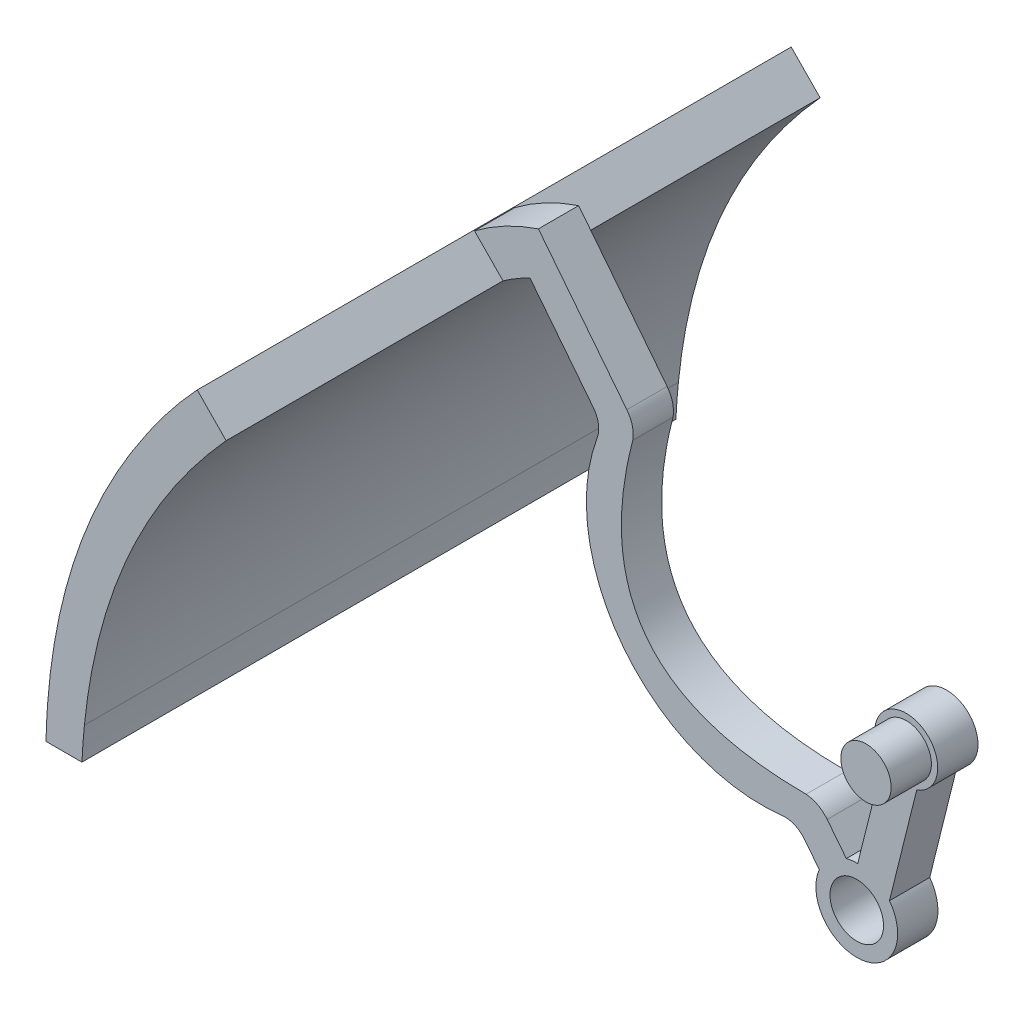
from build123d import *

# Parameters (mm, degrees)
BOSS_EXTRUDE1_DEPTH      = 74.93
BOSS_EXTRUDE4_DEPTH      = 2.54
BOSS_EXTRUDE4_DEPTH_BACK = 2.54
BOSS_EXTRUDE6_DEPTH      = 74.93
BOSS_EXTRUDE7_DEPTH      = 74.93
SKETCH11_R               = 3.3782
BOSS_EXTRUDE8_DEPTH      = 2.54
SKETCH13_R               = 3.971263101
BOSS_EXTRUDE10_DEPTH     = 5.08
SKETCH12_R               = 3.175
BOSS_EXTRUDE9_DEPTH      = 5.08


with BuildPart() as part:
    # Sketch1 → Boss-Extrude1 (new body)
    with BuildSketch(Plane.XY):
        with BuildLine():
            Line((-16.295773791, 0.624640473), (-12.907508233, 0.624640473))
            Line((-12.907508233, 0.624640473), (-12.443267089, 3.164640473))
            add(Edge.make_bspline(
                [(-12.443267089, 3.164640473), (-12.30668745, 3.911907895), (-11.89696139, 6.153716378), (-11.35075536, 9.142778811), (-10.941162808, 11.384616955), (-10.804635025, 12.131895145)],
                knots=[0.002076118, 0.002076118, 0.002076118, 0.002076118, 0.004355051, 0.008912916, 0.011191849, 0.011191849, 0.011191849, 0.011191849], degree=3))
            add(Edge.make_bspline(
                [(-10.804635025, 12.131895145), (-10.131787944, 14.813925559), (-8.428636773, 20.08894476), (-4.769918918, 27.602373316), (-0.882056925, 33.370017928), (2.696640916, 37.629074894), (4.663596703, 39.6688962), (5.677623009, 40.647244333)],
                knots=[-0.595137067, -0.595137067, -0.595137067, -0.595137067, -0.254899084, 0.0853389, 0.425576884, 0.595695875, 0.765814867, 0.765814867, 0.765814867, 0.765814867], degree=3))
            Line((5.677623009, 40.647244333), (2.03170084, 44.371046934))
            add(Edge.make_bspline(
                [(2.03170084, 44.371046934), (1.545061943, 43.849333503), (0.584048879, 42.784657511), (-1.227882281, 40.634272171), (-4.205920413, 36.737641226), (-7.868630072, 30.842728735), (-11.285075765, 23.259160615), (-12.891126954, 17.928422411), (-13.516382283, 15.22778531)],
                knots=[0.192222826, 0.192222826, 0.192222826, 0.192222826, 0.287167093, 0.38211136, 0.571999893, 0.951776961, 1.331554028, 1.711331096, 1.711331096, 1.711331096, 1.711331096], degree=3))
            add(Edge.make_bspline(
                [(-13.516382283, 15.22778531), (-13.707651088, 14.222513225), (-14.09021448, 12.211975656), (-14.664139503, 9.196174334), (-15.238140346, 6.180406911), (-15.620861993, 4.169893716), (-15.812232602, 3.164640473)],
                knots=[-0.00268258, -0.00268258, -0.00268258, -0.00268258, 0.000387339, 0.003457258, 0.006527177, 0.009597097, 0.009597097, 0.009597097, 0.009597097], degree=3))
            Line((-15.812232602, 3.164640473), (-16.295773791, 0.624640473))
        make_face()
    extrude(amount=BOSS_EXTRUDE1_DEPTH)

    # Sketch4 → Boss-Extrude4 (add, two sides: drawn at the far end of the back side and taken through both)
    with BuildSketch(Plane(origin=(0, 0, 37.465), x_dir=(-1, 0, 0), z_dir=(0, 0, -1)).offset(-BOSS_EXTRUDE4_DEPTH_BACK)):
        with BuildLine():
            Line((-5.677623009, 40.647244333), (-2.087143894, 44.314419562))
            ThreePointArc((-2.087143894, 44.314419562), (-5.945357936, 46.761917563), (-10.144870483, 48.561961011))
            Line((-10.144870483, 48.561961011), (-12.342217859, 43.933321468))
            ThreePointArc((-12.342217859, 43.933321468), (-8.878894593, 42.556020468), (-5.677623009, 40.647244333))
        make_face()
    extrude(amount=BOSS_EXTRUDE4_DEPTH + BOSS_EXTRUDE4_DEPTH_BACK)

    # Sketch8 → Boss-Extrude6 (add)
    with BuildSketch(Plane(origin=(0, 0, 0), x_dir=(-1, 0, 0), z_dir=(0, 0, -1))):
        with BuildLine():
            Line((12.199993526, 0.628671187), (16.843743367, 0.628671187))
            add(Edge.make_bspline(
                [(-2.03170084, 44.371046934), (15.008940659, 25.494574417), (16.843743367, 0.628671187)],
                knots=[0, 0, 0, 1, 1, 1], degree=2))
            Line((-2.03170084, 44.371046934), (-5.677623009, 40.647244333))
            add(Edge.make_bspline(
                [(-5.677623009, 40.647244333), (9.879032096, 23.52153238), (12.199993526, 0.628671187)],
                knots=[0, 0, 0, 1, 1, 1], degree=2))
        make_face()
    extrude(amount=-BOSS_EXTRUDE6_DEPTH)

    # Sketch10 → Boss-Extrude7 (add)
    with BuildSketch(Plane.XY.offset(74.93)):
        with BuildLine():
            add(Edge.make_bspline(
                [(-17.044210577, -3.569022053), (-16.99706974, -1.449262713), (-16.843743367, 0.628671187)],
                knots=[0, 0, 0, 1, 1, 1], degree=2))
            Line((-16.843743367, 0.628671187), (-16.295006462, 0.628671187))
            Line((-16.295006462, 0.628671187), (-16.295773791, 0.624640473))
            Line((-16.295773791, 0.624640473), (-12.907508233, 0.624640473))
            Line((-12.907508233, 0.624640473), (-12.906771531, 0.628671187))
            Line((-12.906771531, 0.628671187), (-12.199993526, 0.628671187))
            add(Edge.make_bspline(
                [(-12.199993526, 0.628671187), (-12.410380076, -1.44648182), (-12.512012235, -3.569022053)],
                knots=[0, 0, 0, 1, 1, 1], degree=2))
            Line((-12.512012235, -3.569022053), (-17.044210577, -3.569022053))
        make_face()
    extrude(amount=-BOSS_EXTRUDE7_DEPTH)

    # Sketch11 → Boss-Extrude8 (add, symmetric)
    with BuildSketch(Plane(origin=(0, 0, 37.465), x_dir=(-1, 0, 0), z_dir=(0, 0, -1))):
        with BuildLine():
            Line((-6.661684739, 45.739942581), (-10.144870483, 48.561961011))
            Line((-10.144870483, 48.561961011), (-21.30072948, 34.383167777))
            ThreePointArc((-21.30072948, 34.383167777), (-21.992768178, 32.976186787), (-22.052439991, 31.409358033))
            add(Edge.make_bspline(
                [(-43.921175132, 3.682891736), (-14.804010115, 3.685410597), (-22.052439991, 31.409358033)],
                knots=[0, 0, 0, 1, 1, 1], degree=2))
            ThreePointArc((-43.921175132, 3.682891736), (-45.398270297, 3.247037241), (-46.577742371, 2.256772178))
            Line((-46.577742371, 2.256772178), (-48.989981542, -0.809118172))
            ThreePointArc((-48.989981542, -0.809118172), (-49.700911454, -0.673916534), (-50.423765203, -0.639517698))
            Line((-50.423765203, -0.639517698), (-54.431438085, 15.399576445))
            ThreePointArc((-54.431438085, 15.399576445), (-57.076455171, 16.988173168), (-58.666731899, 14.344165819))
            Line((-58.666731899, 14.344165819), (-54.431438085, -2.697927839))
            ThreePointArc((-54.431438085, -2.697927839), (-50.902490469, -10.922372789), (-45.581657306, -3.726283541))
            Line((-45.581657306, -3.726283541), (-43.706337234, -1.342802757))
            ThreePointArc((-43.706337234, -1.342802757), (-42.430425985, -0.374532318), (-40.844196848, -0.152329073))
            ThreePointArc((-40.844196848, -0.152329073), (-20.926969962, 8.132007566), (-17.561546975, 29.439285396))
            ThreePointArc((-17.561546975, 29.439285396), (-17.718806517, 31.033263625), (-17.077929798, 32.501178536))
            Line((-17.077929798, 32.501178536), (-11.948808892, 39.020151644))
            Line((-11.948808892, 39.020151644), (-6.661684739, 45.739942581))
        make_face()
        with Locations((-50.306976812, -5.797526095)):
            Circle(SKETCH11_R, mode=Mode.SUBTRACT)
    extrude(amount=BOSS_EXTRUDE8_DEPTH, both=True)

    # Sketch13 → Boss-Extrude10 (add)
    with BuildSketch(Plane.XY.offset(40.005)):
        with Locations((56.548749752, 14.870525834)):
            Circle(SKETCH13_R)
    extrude(amount=-BOSS_EXTRUDE10_DEPTH)

    # Sketch12 → Boss-Extrude9 (add)
    with BuildSketch(Plane.XY.offset(40.005)):
        with Locations(Location((56.548749752, 14.870525834, 0), (0, 0, 180))):
            Circle(SKETCH12_R)
    extrude(amount=BOSS_EXTRUDE9_DEPTH)


solid = part.part
